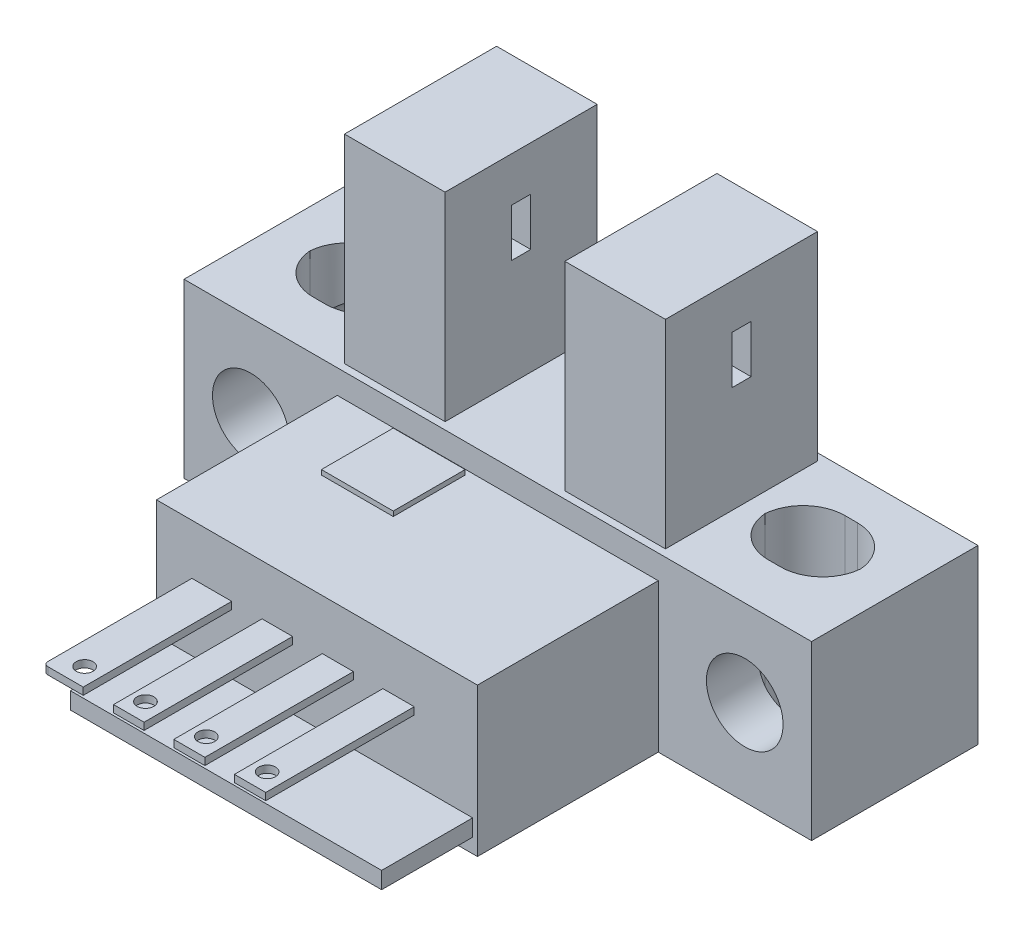
from build123d import *

# Parameters (mm, degrees)
SKETCH1_W                = 26.2
SKETCH1_H                = 7.2
SKETCH1_R                = 1.6
BOSS_EXTRUDE1_DEPTH      = 6.95
BOSS_EXTRUDE2_DEPTH      = 3.175
BOSS_EXTRUDE2_DEPTH_BACK = 3.175
SKETCH2_W                = 4.2
SKETCH2_H                = 8.3
SKETCH3_W                = 0.8
SKETCH3_H                = 2
CUT_EXTRUDE1_DEPTH       = 27.088167816
SKETCH4_W                = 13.4
SKETCH4_H                = 6.2
BOSS_EXTRUDE3_DEPTH      = 7.55
SKETCH5_W                = 13
SKETCH5_H                = 0.7
BOSS_EXTRUDE4_DEPTH      = 3.8
SKETCH6_W                = 11.057539052
SKETCH6_H                = 0.3
BOSS_EXTRUDE5_DEPTH      = 6.2
SKETCH7_R                = 0.35
SKETCH7_W                = 0.673728729
SKETCH7_H                = 6.2
SKETCH7_W_2              = 0.592367936
SKETCH7_W_3              = 0.568302757
SKETCH7_W_4              = 0.558499764
SKETCH7_W_5              = 0.793155974
CUT_EXTRUDE3_DEPTH       = 2
CUT_EXTRUDE4_DEPTH       = 26.864841001
SKETCH10_W               = 3
SKETCH10_H               = 3
BOSS_EXTRUDE6_DEPTH      = 0.2


with BuildPart() as part:
    # Sketch1 → Boss-Extrude1 (new body)
    with BuildSketch(Plane.XY):
        with Locations((0, 3.6)):
            Rectangle(SKETCH1_W, SKETCH1_H)
        with Locations((-10.311776953, 3.6)):
            Circle(SKETCH1_R, mode=Mode.SUBTRACT)
        with Locations(Location((10.311776953, 3.6, 0), (0, 0, 180))):
            Circle(SKETCH1_R, mode=Mode.SUBTRACT)
    extrude(amount=BOSS_EXTRUDE1_DEPTH)

    # Sketch2 → Boss-Extrude2 (add, two sides: drawn at the far end of the back side and taken through both)
    with BuildSketch(Plane.XY.offset(3.475).offset(-BOSS_EXTRUDE2_DEPTH_BACK)):
        with Locations((-4.6, 11.35)):
            Rectangle(SKETCH2_W, SKETCH2_H)
        with Locations((4.6, 11.35)):
            Rectangle(SKETCH2_W, SKETCH2_H)
    extrude(amount=BOSS_EXTRUDE2_DEPTH + BOSS_EXTRUDE2_DEPTH_BACK)

    # Sketch3 → Cut-Extrude1 (cut, through all)
    with BuildSketch(Plane.ZY.offset(6.7)):
        with Locations((3.475, 12.64)):
            Rectangle(SKETCH3_W, SKETCH3_H)
    extrude(amount=-CUT_EXTRUDE1_DEPTH, mode=Mode.SUBTRACT)

    # Sketch4 → Boss-Extrude3 (add)
    with BuildSketch(Plane.XY.offset(6.95)):
        with Locations((0, 3.1)):
            Rectangle(SKETCH4_W, SKETCH4_H)
    extrude(amount=BOSS_EXTRUDE3_DEPTH)

    # Sketch5 → Boss-Extrude4 (add)
    with BuildSketch(Plane.XY.offset(14.5)):
        with Locations((0, 0.95)):
            Rectangle(SKETCH5_W, SKETCH5_H)
    extrude(amount=BOSS_EXTRUDE4_DEPTH)

    # Sketch6 → Boss-Extrude5 (add)
    with BuildSketch(Plane.XY.offset(14.5)):
        with Locations((0, 3.95)):
            Rectangle(SKETCH6_W, SKETCH6_H)
    extrude(amount=BOSS_EXTRUDE5_DEPTH)

    # Sketch7 → Cut-Extrude3 (cut)
    with BuildSketch(Plane(origin=(0, 4.1, 0), x_dir=(1, 0, 0), z_dir=(0, 1, 0))):
        Polygon((-5.219979377, -20.517795083), (-5.219979377, -14.5), (-5.528769526, -14.5), (-5.528769526, -20.7), (-5.219979377, -20.7), align=None)
        with Locations(Location((-4.273866855, -19.926328783, 0), (0, 0, 180))):
            Circle(SKETCH7_R)
        with Locations((-3.221250813, -17.6)):
            Rectangle(SKETCH7_W, SKETCH7_H)
        with Locations((-2.58820248, -17.6)):
            Rectangle(SKETCH7_W_2, SKETCH7_H)
        with Locations(Location((-1.733866855, -19.926328783, 0), (0, 0, 180))):
            Circle(SKETCH7_R)
        with Locations((-0.681250813, -17.6)):
            Rectangle(SKETCH7_W, SKETCH7_H)
        with Locations((-0.06023507, -17.6)):
            Rectangle(SKETCH7_W_3, SKETCH7_H)
        with Locations((1.858749188, -17.6)):
            Rectangle(SKETCH7_W, SKETCH7_H)
        with Locations((2.474863434, -17.6)):
            Rectangle(SKETCH7_W_4, SKETCH7_H)
        with Locations((4.398749187, -17.6)):
            Rectangle(SKETCH7_W, SKETCH7_H)
        with Locations((5.132191539, -17.6)):
            Rectangle(SKETCH7_W_5, SKETCH7_H)
        with BuildLine():
            Line((-5.219979377, -20.7), (-5.03777446, -20.7))
            ThreePointArc((-5.03777446, -20.7), (-5.166612793, -20.646633415), (-5.219979377, -20.517795083))
            Line((-5.219979377, -20.517795083), (-5.219979377, -20.7))
        make_face()
        with Locations(Location((0.806133145, -19.926328783, 0), (0, 0, 180))):
            Circle(SKETCH7_R)
        with Locations(Location((3.346133145, -19.926328783, 0), (0, 0, 180))):
            Circle(SKETCH7_R)
    extrude(amount=-CUT_EXTRUDE3_DEPTH, mode=Mode.SUBTRACT)

    # Sketch9 → Cut-Extrude4 (cut, through all)
    with BuildSketch(Plane(origin=(0, 7.2, 0), x_dir=(1, 0, 0), z_dir=(0, 1, 0))):
        with BuildLine():
            Line((9.243559577, -4.896961438), (9.756440423, -4.896961438))
            ThreePointArc((9.756440423, -4.896961438), (10.939656379, -4.436341133), (11.5, -3.296961438))
            ThreePointArc((11.5, -3.296961438), (10.939656379, -2.157581742), (9.756440423, -1.696961438))
            Line((9.756440423, -1.696961438), (9.243559577, -1.696961438))
            ThreePointArc((9.243559577, -1.696961438), (8.060343621, -2.157581742), (7.5, -3.296961438))
            ThreePointArc((7.5, -3.296961438), (8.060343621, -4.436341133), (9.243559577, -4.896961438))
        make_face()
        with BuildLine():
            Line((-9.243559577, -4.896961438), (-9.756440423, -4.896961438))
            ThreePointArc((-9.756440423, -4.896961438), (-10.939656379, -4.436341133), (-11.5, -3.296961438))
            ThreePointArc((-11.5, -3.296961438), (-10.939656379, -2.157581742), (-9.756440423, -1.696961438))
            Line((-9.756440423, -1.696961438), (-9.243559577, -1.696961438))
            ThreePointArc((-9.243559577, -1.696961438), (-8.060343621, -2.157581742), (-7.5, -3.296961438))
            ThreePointArc((-7.5, -3.296961438), (-8.060343621, -4.436341133), (-9.243559577, -4.896961438))
        make_face()
    extrude(amount=-CUT_EXTRUDE4_DEPTH, mode=Mode.SUBTRACT)

    # Sketch10 → Boss-Extrude6 (add)
    with BuildSketch(Plane(origin=(0, 6.2, 0), x_dir=(1, 0, 0), z_dir=(0, 1, 0))):
        with Locations((-2.650474803, -8.66301906)):
            Rectangle(SKETCH10_W, SKETCH10_H)
    extrude(amount=BOSS_EXTRUDE6_DEPTH)


solid = part.part
